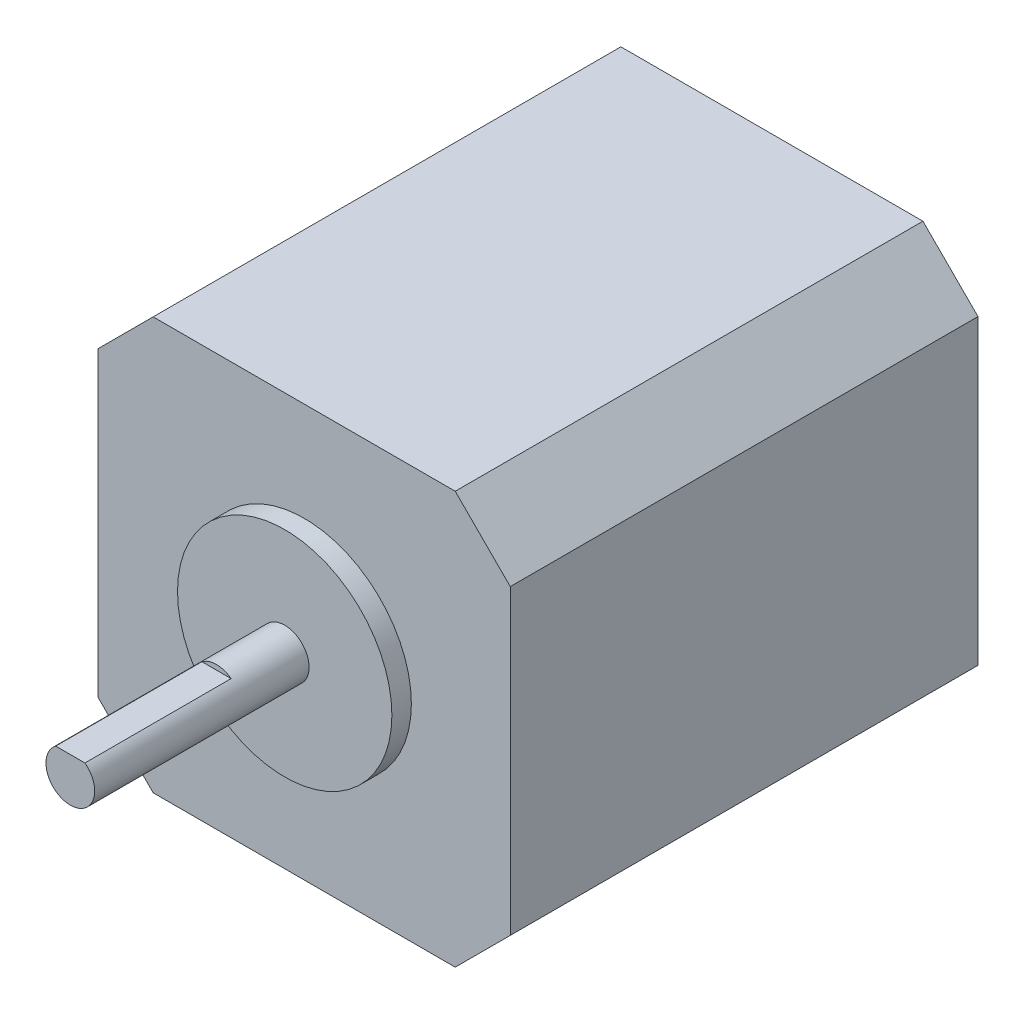
from build123d import *

# Parameters (mm, degrees)
BOSS_EXTRUDE1_DEPTH = 48
SKETCH3_R           = 11
BOSS_EXTRUDE2_DEPTH = 2
SKETCH4_R           = 2.5
BOSS_EXTRUDE3_DEPTH = 22
CUT_EXTRUDE2_START  = -15
CUT_EXTRUDE2_DEPTH  = 15


with BuildPart() as part:
    # Sketch2 → Boss-Extrude1 (new body)
    with BuildSketch(Plane.XY):
        Polygon((5.65, 0), (36.65, 0), (42.3, 5.65), (42.3, 36.65), (36.65, 42.3), (5.65, 42.3), (0, 36.65), (0, 5.65), align=None)
    extrude(amount=BOSS_EXTRUDE1_DEPTH)

    # Sketch3 → Boss-Extrude2 (add)
    with BuildSketch(Plane.XY.offset(48)):
        with Locations((21.15, 21.15)):
            Circle(SKETCH3_R)
    extrude(amount=BOSS_EXTRUDE2_DEPTH)

    # Sketch4 → Boss-Extrude3 (add)
    with BuildSketch(Plane.XY.offset(50)):
        with Locations((21.15, 21.15)):
            Circle(SKETCH4_R)
    extrude(amount=BOSS_EXTRUDE3_DEPTH)

    # Sketch5 → Cut-Extrude2 (cut)
    with BuildSketch(Plane.XY.offset(72).offset(CUT_EXTRUDE2_START)):
        with BuildLine():
            ThreePointArc((19.65, 23.15), (20.359430585, 23.521708245), (21.15, 23.65))
            ThreePointArc((21.15, 23.65), (21.940569415, 23.521708245), (22.65, 23.15))
            Line((22.65, 23.15), (25.205995561, 23.15))
            Line((25.205995561, 23.15), (25.205995561, 25.058533995))
            Line((25.205995561, 25.058533995), (17.955034994, 25.058533995))
            Line((17.955034994, 25.058533995), (17.955034994, 23.15))
            Line((17.955034994, 23.15), (19.65, 23.15))
        make_face()
        with BuildLine():
            ThreePointArc((22.65, 23.15), (21.940569415, 23.521708245), (21.15, 23.65))
            Line((21.15, 23.65), (21.15, 23.15))
            Line((21.15, 23.15), (22.65, 23.15))
        make_face()
        with BuildLine():
            Line((21.15, 23.15), (21.15, 23.65))
            ThreePointArc((21.15, 23.65), (20.359430585, 23.521708245), (19.65, 23.15))
            Line((19.65, 23.15), (21.15, 23.15))
        make_face()
    extrude(amount=CUT_EXTRUDE2_DEPTH, mode=Mode.SUBTRACT)


solid = part.part
